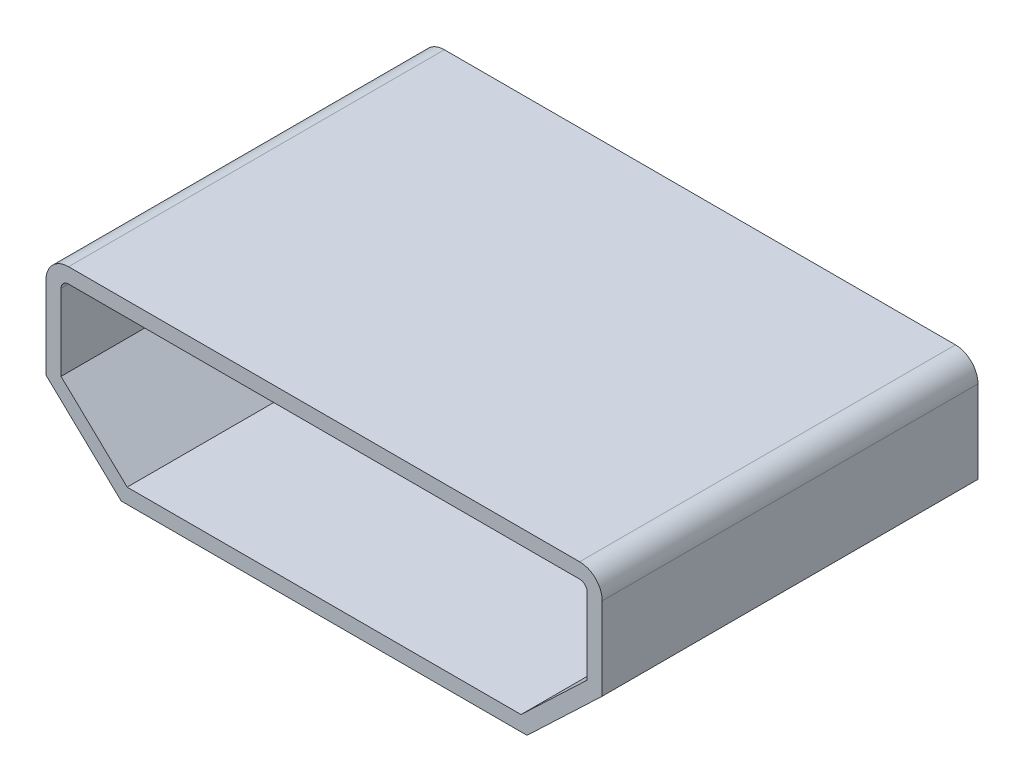
from build123d import *

# Parameters (mm, degrees)
SKETCH1_W           = 7.4
SKETCH1_H           = 5
BOSS_EXTRUDE1_DEPTH = 2.35
CUT_EXTRUDE1_DEPTH  = 7.649248078
CUT_EXTRUDE2_DEPTH  = 4.7


with BuildPart() as part:
    # Sketch1 → Boss-Extrude1 (new body)
    with BuildSketch(Plane(origin=(0, 0, 0), x_dir=(1, 0, 0), z_dir=(0, 1, 0))):
        Rectangle(SKETCH1_W, SKETCH1_H)
    extrude(amount=BOSS_EXTRUDE1_DEPTH)

    # Sketch2 → Cut-Extrude1 (cut, through all)
    with BuildSketch(Plane.XY.offset(2.5)):
        Polygon((3.7, 0), (2.7, 0), (3.7, 0.95), align=None)
        Polygon((-2.7, 0), (-3.7, 0.95), (-3.7, 0), align=None)
        with BuildLine():
            Line((-3.7, 2.05), (-3.7, 2.35))
            Line((-3.7, 2.35), (-3.4, 2.35))
            ThreePointArc((-3.4, 2.35), (-3.612132034, 2.262132034), (-3.7, 2.05))
        make_face()
        with BuildLine():
            Line((3.7, 2.35), (3.4, 2.35))
            ThreePointArc((3.4, 2.35), (3.612132034, 2.262132034), (3.7, 2.05))
            Line((3.7, 2.05), (3.7, 2.35))
        make_face()
    extrude(amount=-CUT_EXTRUDE1_DEPTH, mode=Mode.SUBTRACT)

    # Sketch3 → Cut-Extrude2 (cut)
    with BuildSketch(Plane.XY.offset(2.5)):
        with BuildLine():
            Line((3.5, 2.05), (3.5, 1.035862284))
            Line((3.5, 1.035862284), (2.620144964, 0.2))
            Line((2.620144964, 0.2), (-2.620144964, 0.2))
            Line((-2.620144964, 0.2), (-3.5, 1.035862284))
            Line((-3.5, 1.035862284), (-3.5, 2.05))
            ThreePointArc((-3.5, 2.05), (-3.470710678, 2.120710678), (-3.4, 2.15))
            Line((-3.4, 2.15), (3.4, 2.15))
            ThreePointArc((3.4, 2.15), (3.470710678, 2.120710678), (3.5, 2.05))
        make_face()
    extrude(amount=-CUT_EXTRUDE2_DEPTH, mode=Mode.SUBTRACT)


solid = part.part
